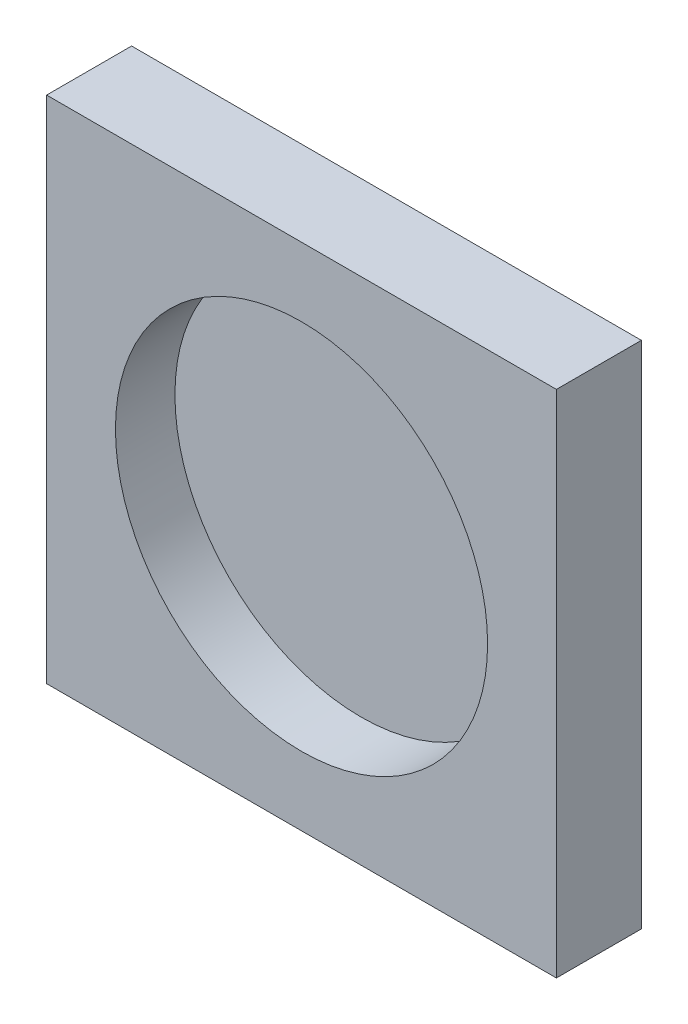
from build123d import *

# Parameters (mm, degrees)
SKETCH1_W           = 60
SKETCH1_H           = 60
BOSS_EXTRUDE1_DEPTH = 10
SKETCH2_R           = 21.9
CUT_EXTRUDE1_DEPTH  = 7


with BuildPart() as part:
    # Sketch1 → Boss-Extrude1 (new body)
    with BuildSketch(Plane.XY):
        Rectangle(SKETCH1_W, SKETCH1_H)
    extrude(amount=BOSS_EXTRUDE1_DEPTH)

    # Sketch2 → Cut-Extrude1 (cut)
    with BuildSketch(Plane.XY.offset(10)):
        Circle(SKETCH2_R)
    extrude(amount=-CUT_EXTRUDE1_DEPTH, mode=Mode.SUBTRACT)


solid = part.part
